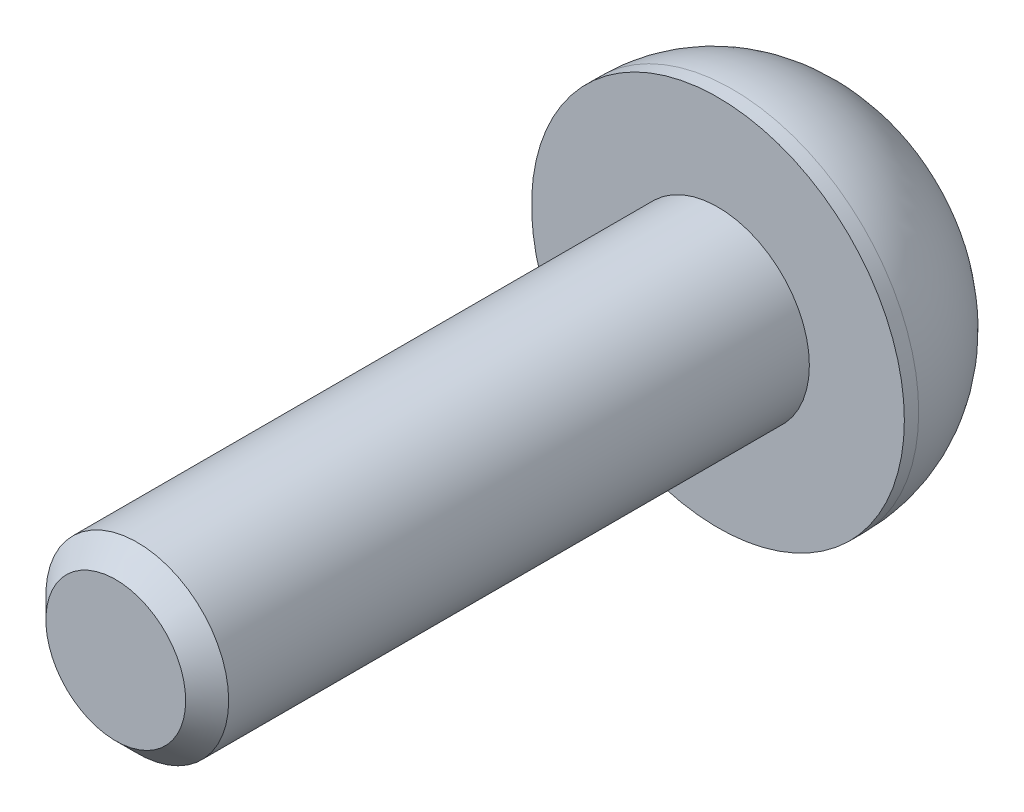
from build123d import *

# Parameters (mm, degrees)
SKICA1_R                 = 2.6
P_IDAT_VYSUNUT_M1_DEPTH  = 2.2
SKICA2_R                 = 1.275
P_IDAT_VYSUNUT_M2_DEPTH  = 8.4
ZAOBLIT1_R               = 2
ODEBRAT_VYSUNUT_M1_DEPTH = 0.7
ZKOSEN_1_SIZE            = 0.3


with BuildPart() as part:
    # Skica1 → Přidat vysunutím1 (new body)
    with BuildSketch(Plane.XY):
        Circle(SKICA1_R)
    extrude(amount=P_IDAT_VYSUNUT_M1_DEPTH)

    # Skica2 → Přidat vysunutím2 (add)
    with BuildSketch(Plane.XY.offset(2.2)):
        Circle(SKICA2_R)
    extrude(amount=P_IDAT_VYSUNUT_M2_DEPTH)

    # Zaoblit1
    zaoblit1_edges = [part.edges().sort_by_distance(p)[0] for p in [
        (-2.6, 0, 0),
    ]]
    fillet(zaoblit1_edges, radius=ZAOBLIT1_R)

    # Skica3 → Odebrat vysunutím1 (cut)
    with BuildSketch(Plane(origin=(0, 0, 0), x_dir=(-1, 0, 0), z_dir=(0, 0, -1))):
        Polygon((-1.65, 0), (-1.65, 0.25), (-0.25, 0.25), (-0.25, 1.65), (0.25, 1.65), (0.25, 0.25), (1.65, 0.25), (1.65, -0.25), (0.25, -0.25), (0.25, -1.65), (-0.25, -1.65), (-0.25, -0.25), (-1.65, -0.25), align=None)
    extrude(amount=-ODEBRAT_VYSUNUT_M1_DEPTH, mode=Mode.SUBTRACT)

    # Zkosení1
    zkosen_1_edges = [part.edges().sort_by_distance(p)[0] for p in [
        (-1.275, 0, 10.6),
    ]]
    chamfer(zkosen_1_edges, length=ZKOSEN_1_SIZE)


solid = part.part
